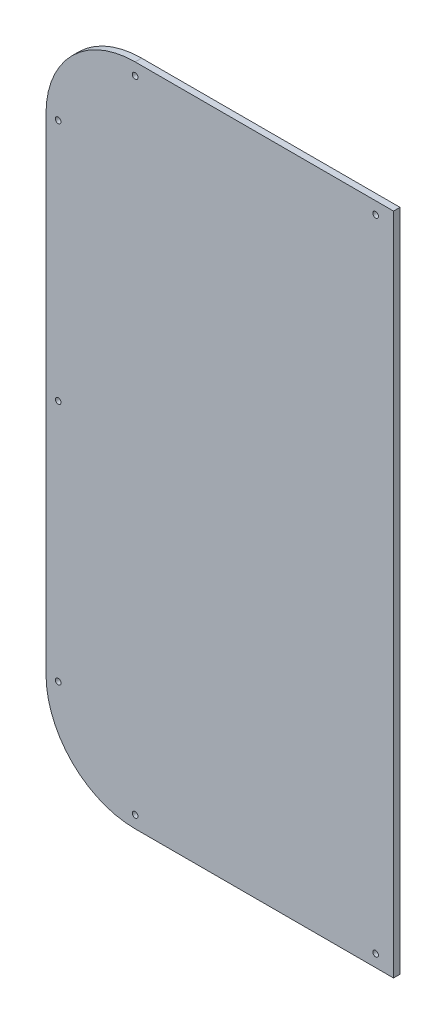
from build123d import *

# Parameters (mm, degrees)
SKETCH1_R           = 1.75
BOSS_EXTRUDE1_DEPTH = 4


with BuildPart() as part:
    # Sketch1 → Boss-Extrude1 (new body)
    with BuildSketch(Plane.XY):
        with BuildLine():
            Line((2023.821699886, 391.448846192), (2023.821699886, -18.551153808))
            Line((2023.821699886, -18.551153808), (1864.321699886, -18.551153808))
            ThreePointArc((1864.321699886, -18.551153808), (1825.430826921, -2.442026773), (1809.321699886, 36.448846192))
            Line((1809.321699886, 36.448846192), (1809.321699886, 336.448846192))
            ThreePointArc((1809.321699886, 336.448846192), (1825.430826921, 375.339719157), (1864.321699886, 391.448846192))
            Line((1864.321699886, 391.448846192), (2023.821699886, 391.448846192))
        make_face()
        with Locations((2012.76292798, -11.051153808)):
            Circle(SKETCH1_R, mode=Mode.SUBTRACT)
        with Locations((1864.321699886, -11.051153808)):
            Circle(SKETCH1_R, mode=Mode.SUBTRACT)
        with Locations((1816.821699886, 36.448846192)):
            Circle(SKETCH1_R, mode=Mode.SUBTRACT)
        with Locations((1816.821699886, 186.448846192)):
            Circle(SKETCH1_R, mode=Mode.SUBTRACT)
        with Locations((1816.821699886, 336.448846192)):
            Circle(SKETCH1_R, mode=Mode.SUBTRACT)
        with Locations((1864.321699886, 383.948846192)):
            Circle(SKETCH1_R, mode=Mode.SUBTRACT)
        with Locations((2012.76292798, 383.948846192)):
            Circle(SKETCH1_R, mode=Mode.SUBTRACT)
    extrude(amount=BOSS_EXTRUDE1_DEPTH)


solid = part.part
